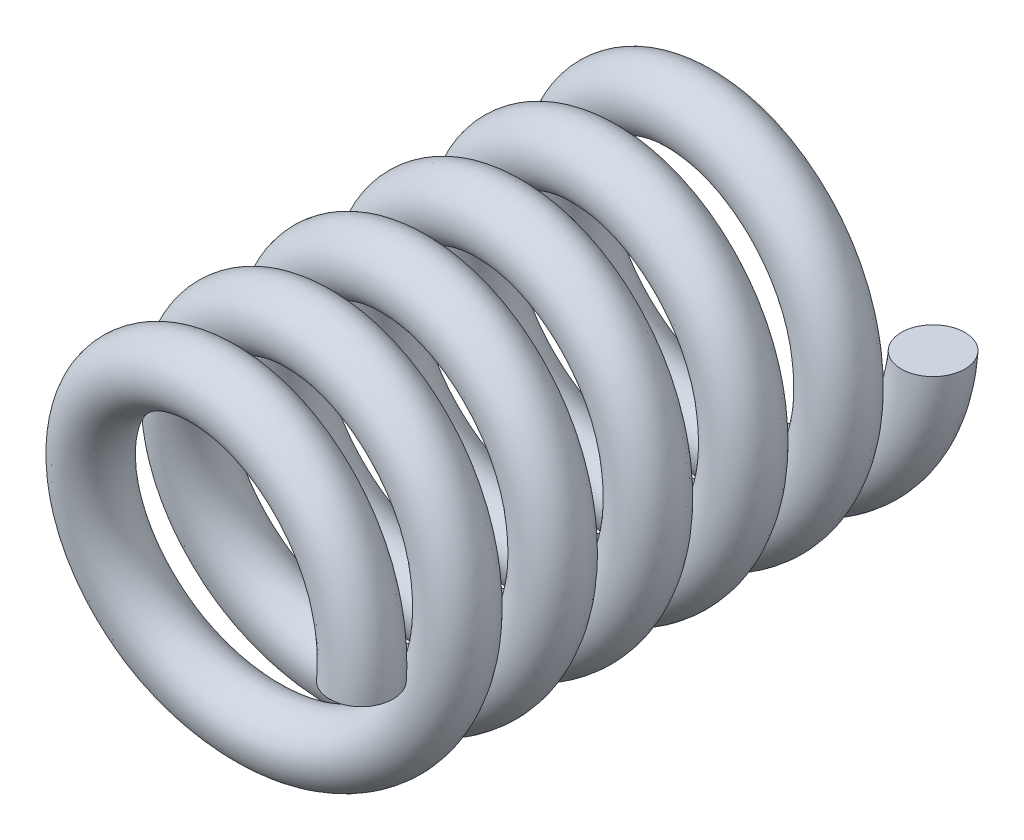
from build123d import *

# Parameters (mm, degrees)
SWEEP1_PITCH  = 1.5
SWEEP1_HEIGHT = 9
SWEEP1_RADIUS = 2.5
SKETCH2_R     = 0.5


with BuildPart() as part:
    # Sweep1: sweep along a helix
    with BuildLine() as sweep1_path:
        Helix(SWEEP1_PITCH, SWEEP1_HEIGHT, SWEEP1_RADIUS, center=(0, 0, 0), direction=(0, 0, 1), lefthand=True)
    # Sketch2 → Sweep1 (sweep)
    with BuildSketch(Plane(origin=(0, 0, 0), x_dir=(1, 0, 0), z_dir=(0, 1, 0))):
        with Locations((2.5, 0)):
            Circle(SKETCH2_R)
    sweep(path=sweep1_path.line, is_frenet=True)


solid = part.part
